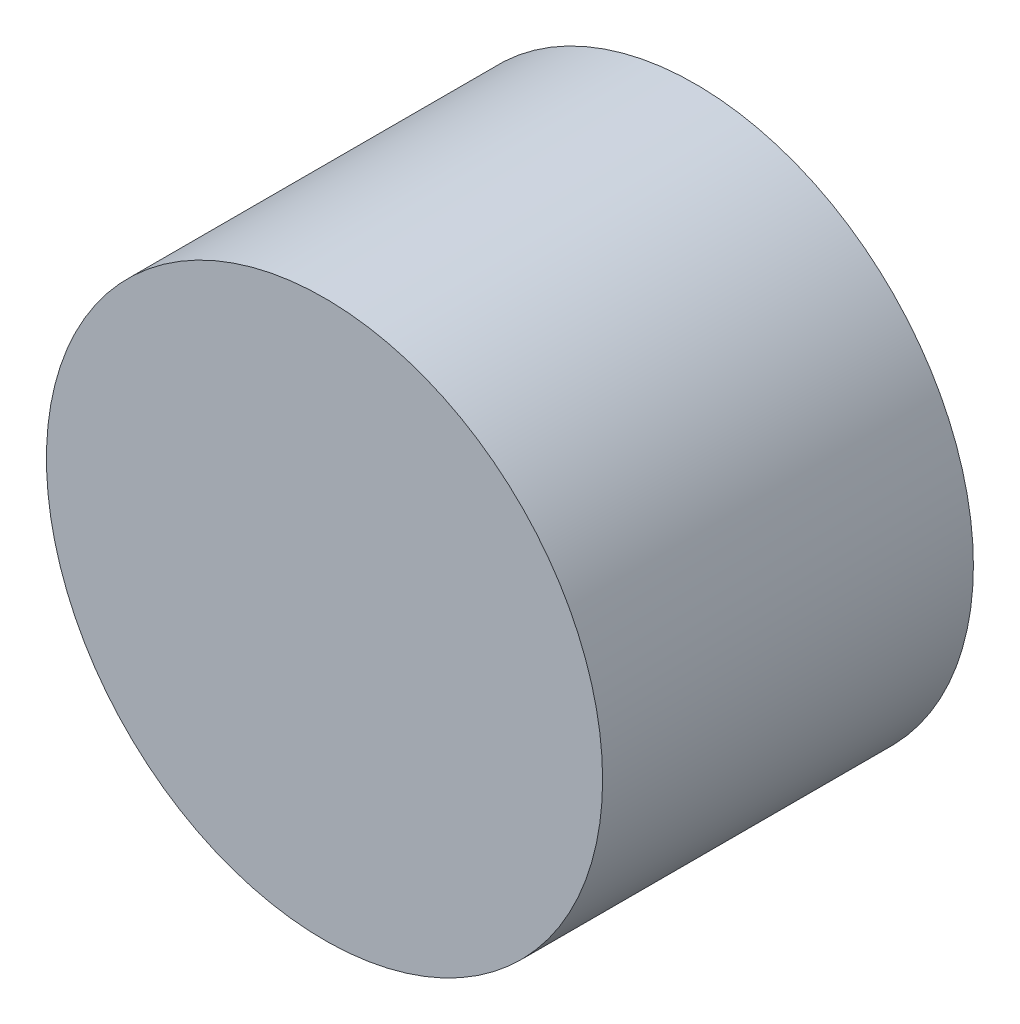
from build123d import *

# Parameters (mm, degrees)
SKETCH1_R           = 38.1
BOSS_EXTRUDE1_DEPTH = 50.8


with BuildPart() as part:
    # Sketch1 → Boss-Extrude1 (new body)
    with BuildSketch(Plane.XY):
        Circle(SKETCH1_R)
    extrude(amount=BOSS_EXTRUDE1_DEPTH)


solid = part.part
